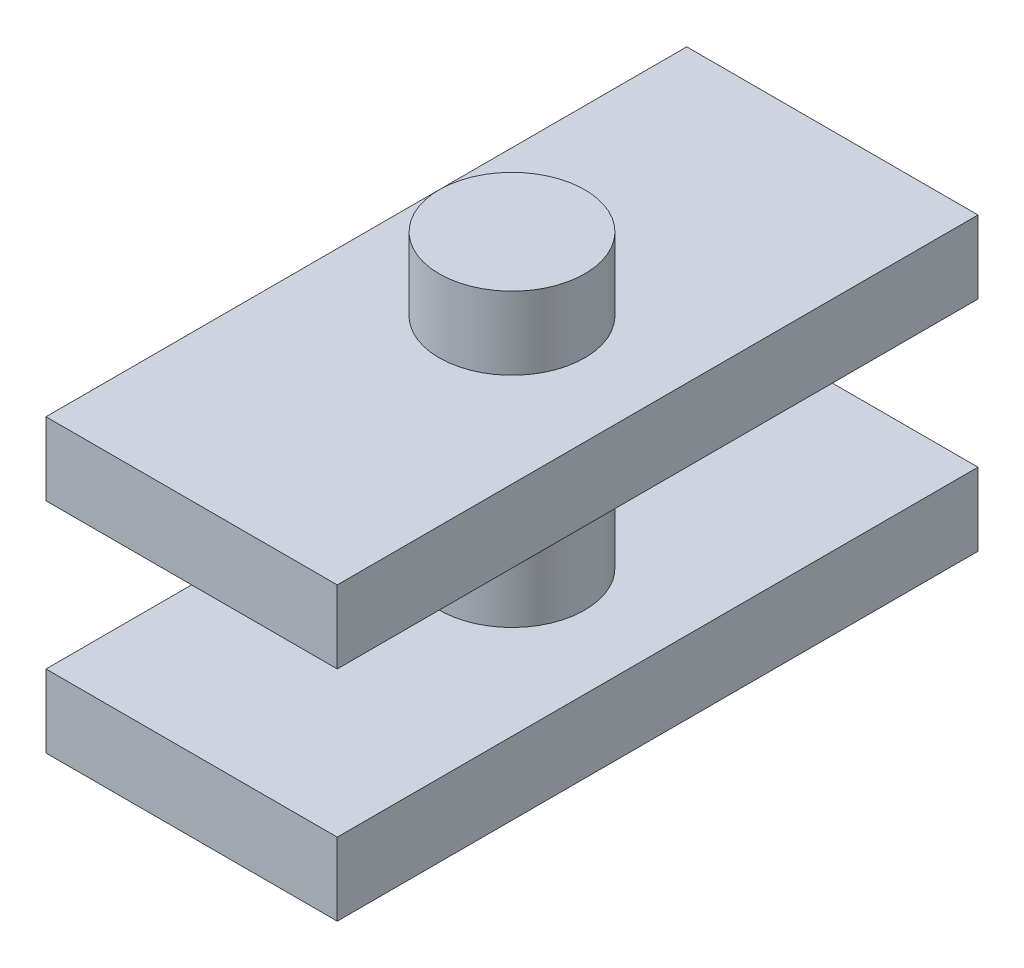
from build123d import *

# Parameters (mm, degrees)
SKETCH1_R           = 5
BOSS_EXTRUDE1_DEPTH = 30
SKETCH2_W           = 20
SKETCH2_H           = 44
BOSS_EXTRUDE2_DEPTH = 10
CUT_EXTRUDE2_START  = -5
SKETCH4_W           = 20
SKETCH4_H           = 44
SKETCH4_R           = 5
CUT_EXTRUDE2_DEPTH  = 5


with BuildPart() as part:
    # Sketch1 → Boss-Extrude1 (new body)
    with BuildSketch(Plane(origin=(0, 0, 0), x_dir=(1, 0, 0), z_dir=(0, 1, 0))):
        with Locations(Location((0, 0, 0), (0, 0, 270))):
            Circle(SKETCH1_R)
    extrude(amount=BOSS_EXTRUDE1_DEPTH)

    # Sketch2 → Boss-Extrude2 (add)
    with BuildSketch(Plane(origin=(0, 30, 0), x_dir=(1, 0, 0), z_dir=(0, 1, 0))):
        Rectangle(SKETCH2_W, SKETCH2_H)
    boss_extrude2 = extrude(amount=-BOSS_EXTRUDE2_DEPTH)

    # Sketch4 → Cut-Extrude2 (cut)
    with BuildSketch(Plane(origin=(0, 30, 0), x_dir=(1, 0, 0), z_dir=(0, 1, 0)).offset(CUT_EXTRUDE2_START)):
        Rectangle(SKETCH4_W, SKETCH4_H)
        with Locations(Location((0, 0, 0), (0, 0, 270))):
            Circle(SKETCH4_R, mode=Mode.SUBTRACT)
    cut_extrude2 = extrude(amount=CUT_EXTRUDE2_DEPTH, mode=Mode.SUBTRACT)

    # Mirror2: Boss-Extrude2, Cut-Extrude2 across plane
    add(boss_extrude2.mirror(Plane(origin=(0, 15, 0), x_dir=(0, 0, 1), z_dir=(0, -1, 0))))
    add(cut_extrude2.mirror(Plane(origin=(0, 15, 0), x_dir=(0, 0, 1), z_dir=(0, -1, 0))), mode=Mode.SUBTRACT)


solid = part.part
